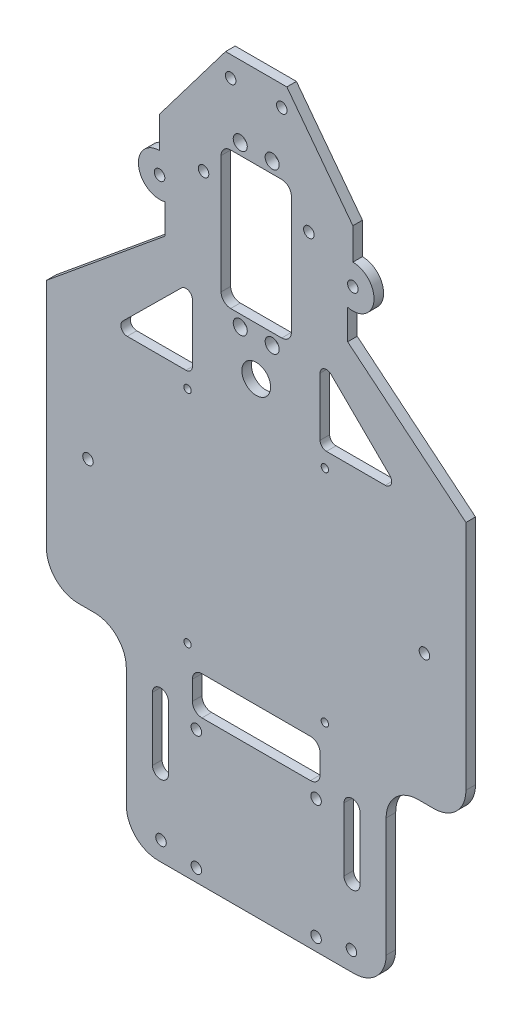
from build123d import *

# Parameters (mm, degrees)
SKETCH1_R           = 1.65
SKETCH1_R_2         = 4.5
SKETCH1_R_3         = 2.2
SKETCH1_R_4         = 1.15
SKETCH1_W           = 22
SKETCH1_H           = 43
SKETCH1_W_2         = 40
SKETCH1_H_2         = 12
BOSS_EXTRUDE1_DEPTH = 3
FILLET2_R           = 3
FILLET3_R           = 2
FILLET4_R           = 10
SKETCH2_W           = 40
SKETCH2_H           = 3
BOSS_EXTRUDE2_DEPTH = 3
SKETCH3_W           = 40
SKETCH3_H           = 3
CUT_EXTRUDE1_DEPTH  = 3
FILLET5_R           = 3


with BuildPart() as part:
    # Sketch1 → Boss-Extrude1 (new body)
    with BuildSketch(Plane.XY):
        with BuildLine():
            Line((-65.69, -25.08927508), (-65.69, -107.741221405))
            Line((-65.69, -107.741221405), (-40.69, -107.741221405))
            Line((-40.69, -107.741221405), (-40.69, -164.982205675))
            Line((-40.69, -164.982205675), (40.69, -164.982205675))
            Line((40.69, -164.982205675), (40.69, -107.741221405))
            Line((40.69, -107.741221405), (65.69, -107.741221405))
            Line((65.69, -107.741221405), (65.69, -25.08927508))
            Line((65.69, -25.08927508), (28.641763355, 5.396592354))
            Line((28.641763355, 5.396592354), (28.641763355, 14.771578959))
            ThreePointArc((28.641763355, 14.771578959), (36.853483101, 20.369604934), (30.2775665, 27.821286413))
            Line((30.2775665, 27.821286413), (30.2775665, 37.695580673))
            Line((30.2775665, 37.695580673), (9.5975665, 65.017794325))
            Line((9.5975665, 65.017794325), (-9.5975665, 65.017794325))
            Line((-9.5975665, 65.017794325), (-30.2775665, 37.695580673))
            Line((-30.2775665, 37.695580673), (-30.2775665, 27.821286413))
            ThreePointArc((-30.2775665, 27.821286413), (-36.853483101, 20.369604934), (-28.641763355, 14.771578959))
            Line((-28.641763355, 14.771578959), (-28.641763355, 5.396592354))
            Line((-28.641763355, 5.396592354), (-65.69, -25.08927508))
        make_face()
        with Locations((-30.2775665, 21.193907325)):
            Circle(SKETCH1_R, mode=Mode.SUBTRACT)
        with Locations((-29.8216785, -158.982205675)):
            Circle(SKETCH1_R, mode=Mode.SUBTRACT)
        with Locations((-52.692806, -67.094311675)):
            Circle(SKETCH1_R, mode=Mode.SUBTRACT)
        with Locations(Location((30.2775665, 21.193907325, 0), (0, 0, 180))):
            Circle(SKETCH1_R, mode=Mode.SUBTRACT)
        with Locations(Location((52.692806, -67.094311675, 0), (0, 0, 180))):
            Circle(SKETCH1_R, mode=Mode.SUBTRACT)
        with Locations(Location((29.8216785, -158.982205675, 0), (0, 0, 180))):
            Circle(SKETCH1_R, mode=Mode.SUBTRACT)
        with Locations((0, -18.982205675)):
            Circle(SKETCH1_R_2, mode=Mode.SUBTRACT)
        with Locations((-16.5, 29.107738598)):
            Circle(SKETCH1_R, mode=Mode.SUBTRACT)
        with Locations(Location((16.5, 29.107738598, 0), (0, 0, 180))):
            Circle(SKETCH1_R, mode=Mode.SUBTRACT)
        with Locations((-8, 58.607738598)):
            Circle(SKETCH1_R, mode=Mode.SUBTRACT)
        with Locations(Location((8, 58.607738598, 0), (0, 0, 180))):
            Circle(SKETCH1_R, mode=Mode.SUBTRACT)
        with Locations((5, 42.607738598)):
            Circle(SKETCH1_R_3, mode=Mode.SUBTRACT)
        with Locations(Location((-5, 42.607738598, 0), (0, 0, 180))):
            Circle(SKETCH1_R_3, mode=Mode.SUBTRACT)
        with Locations(Location((5, -7.392261402, 0), (0, 0, 180))):
            Circle(SKETCH1_R_3, mode=Mode.SUBTRACT)
        with Locations((-5, -7.392261402)):
            Circle(SKETCH1_R_3, mode=Mode.SUBTRACT)
        with Locations((-18.75, -160.982205675)):
            Circle(SKETCH1_R, mode=Mode.SUBTRACT)
        with Locations(Location((18.75, -160.982205675, 0), (0, 0, 180))):
            Circle(SKETCH1_R, mode=Mode.SUBTRACT)
        with Locations((18.75, -123.482205675)):
            Circle(SKETCH1_R, mode=Mode.SUBTRACT)
        with Locations(Location((-18.75, -123.482205675, 0), (0, 0, 180))):
            Circle(SKETCH1_R, mode=Mode.SUBTRACT)
        with Locations((21.5, -101.450066073)):
            Circle(SKETCH1_R_4, mode=Mode.SUBTRACT)
        with Locations(Location((-21.5, -101.450066073, 0), (0, 0, 180))):
            Circle(SKETCH1_R_4, mode=Mode.SUBTRACT)
        with Locations(Location((21.5, -32.450066073, 0), (0, 0, 180))):
            Circle(SKETCH1_R_4, mode=Mode.SUBTRACT)
        with Locations((-21.5, -32.450066073)):
            Circle(SKETCH1_R_4, mode=Mode.SUBTRACT)
        with Locations((0, 17.607738598)):
            Rectangle(SKETCH1_W, SKETCH1_H, mode=Mode.SUBTRACT)
        with Locations((0, -110.450066073)):
            Rectangle(SKETCH1_W_2, SKETCH1_H_2, mode=Mode.SUBTRACT)
        with BuildLine():
            Line((-27.5, -120.270969271), (-27.5, -140.086043436))
            ThreePointArc((-27.5, -140.086043436), (-30, -142.586043436), (-32.5, -140.086043436))
            Line((-32.5, -140.086043436), (-32.5, -120.270969271))
            ThreePointArc((-32.5, -120.270969271), (-30, -117.770969271), (-27.5, -120.270969271))
        make_face(mode=Mode.SUBTRACT)
        with BuildLine():
            Line((27.5, -120.270969271), (27.5, -140.086043436))
            ThreePointArc((27.5, -140.086043436), (30, -142.586043436), (32.5, -140.086043436))
            Line((32.5, -140.086043436), (32.5, -120.270969271))
            ThreePointArc((32.5, -120.270969271), (30, -117.770969271), (27.5, -120.270969271))
        make_face(mode=Mode.SUBTRACT)
        Polygon((20, -2.642677247), (20, -27.641099182), (45.282011772, -27.641099182), align=None, mode=Mode.SUBTRACT)
        Polygon((-20, -27.641099182), (-45.282011772, -27.641099182), (-20, -2.642677247), align=None, mode=Mode.SUBTRACT)
    extrude(amount=BOSS_EXTRUDE1_DEPTH)

    # Fillet2
    fillet2_edges = [part.edges().sort_by_distance(p)[0] for p in [
        (11, -3.892261402, 1.5),
        (11, 39.107738598, 1.5),
        (-11, 39.107738598, 1.5),
        (-11, -3.892261402, 1.5),
    ]]
    fillet(fillet2_edges, radius=FILLET2_R)

    # Fillet3
    fillet3_edges = [part.edges().sort_by_distance(p)[0] for p in [
        (45.282011772, -27.641099182, 1.5),
        (20, -2.642677247, 1.5),
        (20, -27.641099182, 1.5),
        (-20, -27.641099182, 1.5),
        (-20, -2.642677247, 1.5),
        (-45.282011772, -27.641099182, 1.5),
    ]]
    fillet(fillet3_edges, radius=FILLET3_R)

    # Fillet4
    fillet4_edges = [part.edges().sort_by_distance(p)[0] for p in [
        (65.69, -107.741221405, 1.5),
        (40.69, -107.741221405, 1.5),
        (40.69, -164.982205675, 1.5),
        (-40.69, -164.982205675, 1.5),
        (-40.69, -107.741221405, 1.5),
        (-65.69, -107.741221405, 1.5),
    ]]
    fillet(fillet4_edges, radius=FILLET4_R)

    # Sketch2 → Boss-Extrude2 (add)
    with BuildSketch(Plane.XZ.offset(104.450066073)):
        with Locations((0, 1.5)):
            Rectangle(SKETCH2_W, SKETCH2_H)
    extrude(amount=BOSS_EXTRUDE2_DEPTH)

    # Sketch3 → Cut-Extrude1 (cut)
    with BuildSketch(Plane(origin=(0, -116.450066073, 0), x_dir=(1, 0, 0), z_dir=(0, 1, 0))):
        with Locations((0, -1.5)):
            Rectangle(SKETCH3_W, SKETCH3_H)
    extrude(amount=-CUT_EXTRUDE1_DEPTH, mode=Mode.SUBTRACT)

    # Fillet5
    fillet5_edges = [part.edges().sort_by_distance(p)[0] for p in [
        (-20, -107.450066073, 1.5),
        (20, -107.450066073, 1.5),
        (-20, -119.450066073, 1.5),
        (20, -119.450066073, 1.5),
    ]]
    fillet(fillet5_edges, radius=FILLET5_R)


solid = part.part
